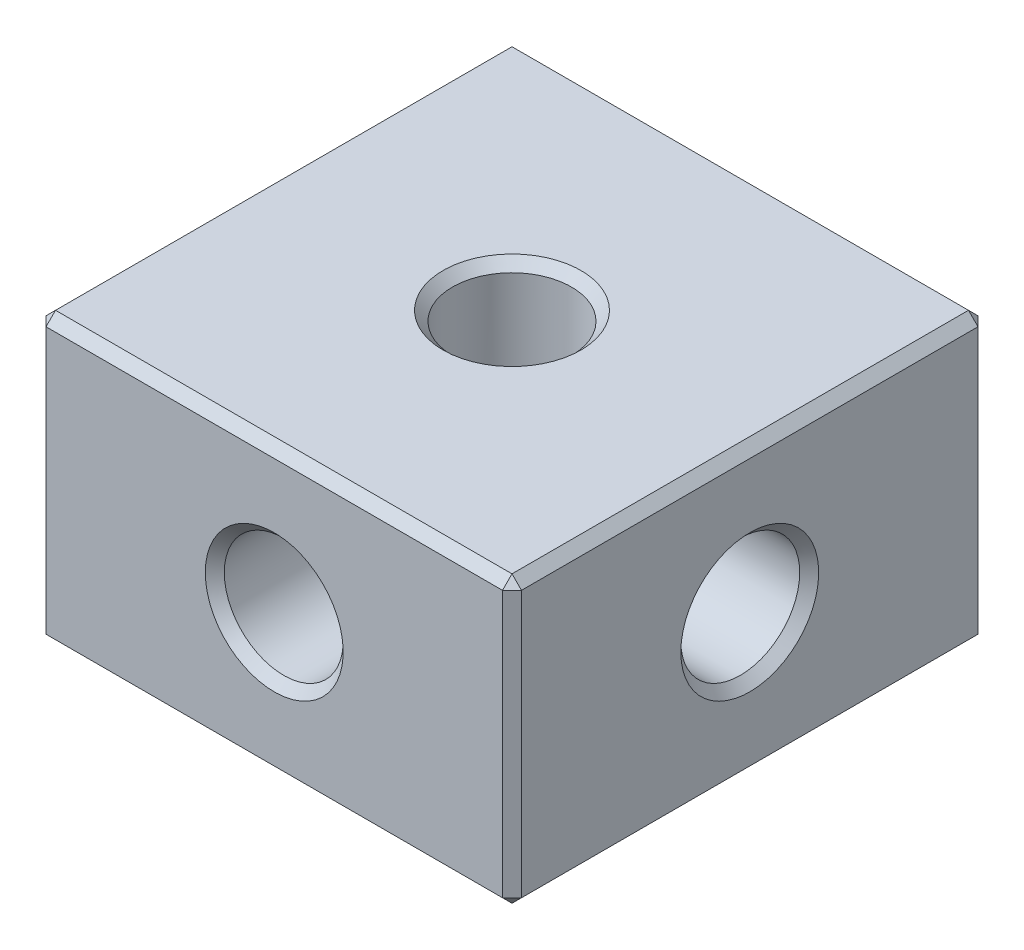
from build123d import *

# Parameters (mm, degrees)
SKETCH_1_W         = 10
SKETCH_1_H         = 10
EXTRUDE_1_DEPTH    = 3
HOLE_WIZARD_M3_1_D = 2.5
HOLE_WIZARD_M3_2_D = 2.5
HOLE_WIZARD_M3_3_D = 2.5
CHAMFER_1_SIZE     = 0.2


with BuildPart() as part:
    # 草图1 → 凸台-拉伸1 (new, symmetric)
    with BuildSketch(Plane(origin=(0, 0, 0), x_dir=(1, 0, 0), z_dir=(0, 1, 0))):
        Rectangle(SKETCH_1_W, SKETCH_1_H)
    extrude(amount=EXTRUDE_1_DEPTH, both=True)

    # M3 螺纹孔1 (through all)
    with Locations(Plane.XY.offset(5)):
        with Locations((0, 0)):
            Hole(HOLE_WIZARD_M3_1_D / 2)

    # M3 螺纹孔2 (through all)
    with Locations(Plane(origin=(0, 3, 0), x_dir=(1, 0, 0), z_dir=(0, 1, 0))):
        with Locations((0, 0)):
            Hole(HOLE_WIZARD_M3_2_D / 2)

    # M3 螺纹孔3 (through all)
    with Locations(Plane(origin=(5, 0, 0), x_dir=(0, 0, -1), z_dir=(1, 0, 0))):
        with Locations((0, 0)):
            Hole(HOLE_WIZARD_M3_3_D / 2)

    # 倒角1
    chamfer_1_edges = [part.edges().sort_by_distance(p)[0] for p in [
        (-5, 3, 0),
        (1.25, 0, 5),
        (1.25, 0, -5),
        (0, 3, 5),
        (1.25, -3, 0),
        (1.25, 3, 0),
        (-5, 0, -1.25),
        (5, 0, -1.25),
        (5, 3, 0),
        (0, -3, 5),
        (-5, -3, 0),
        (0, -3, -5),
        (5, -3, 0),
        (5, 0, 5),
        (-5, 0, 5),
        (-5, 0, -5),
        (5, 0, -5),
        (0, 3, -5),
    ]]
    chamfer(chamfer_1_edges, length=CHAMFER_1_SIZE)


solid = part.part
